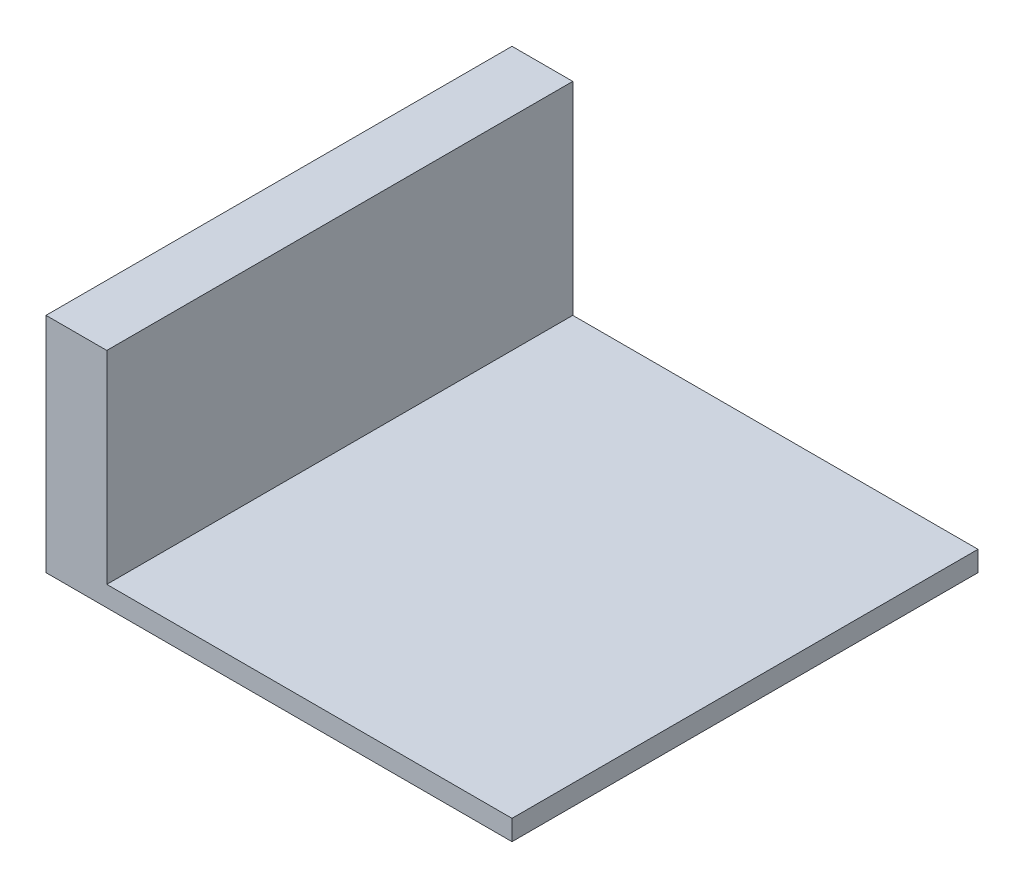
from build123d import *

# Parameters (mm, degrees)
BOSS_EXTRUDE1_DEPTH = 10
SKETCH2_W           = 23
SKETCH2_H           = 23
BOSS_EXTRUDE2_DEPTH = 1


with BuildPart() as part:
    # Sketch1 → Boss-Extrude1 (new body)
    with BuildSketch(Plane(origin=(0, 0, 0), x_dir=(1, 0, 0), z_dir=(0, 1, 0))):
        Polygon((-36.489872914, 17.750117647), (-36.489872914, -2.249882353), (-33.489872914, -2.249882353), (-33.489872914, 0.750117647), (-33.489872914, 20.750117647), (-36.489872914, 20.750117647), align=None)
    extrude(amount=BOSS_EXTRUDE1_DEPTH)

    # Sketch2 → Boss-Extrude2 (add)
    with BuildSketch(Plane.XZ):
        with Locations((-24.989872914, -9.250117647)):
            Rectangle(SKETCH2_W, SKETCH2_H)
    extrude(amount=BOSS_EXTRUDE2_DEPTH)


solid = part.part
